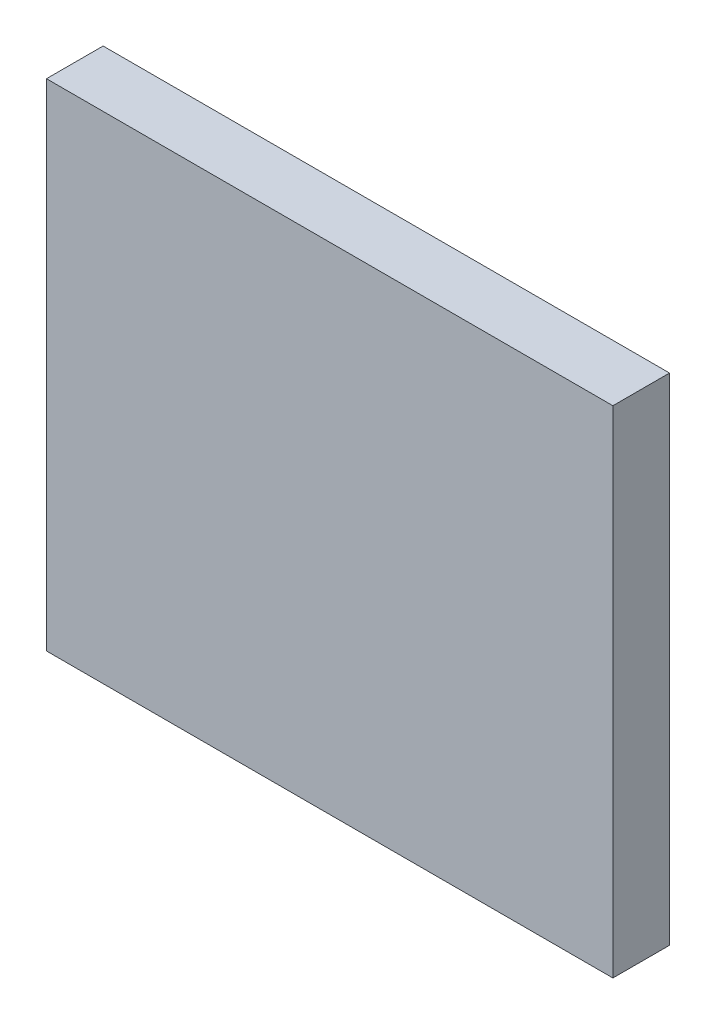
from build123d import *

# Parameters (mm, degrees)
SKETCH1_W     = 40
SKETCH1_H     = 35
PROFILE_DEPTH = 4


with BuildPart() as part:
    # Sketch1 → Profile (new body)
    with BuildSketch(Plane.XY):
        with Locations((20, 17.5)):
            Rectangle(SKETCH1_W, SKETCH1_H)
    extrude(amount=PROFILE_DEPTH)


solid = part.part
